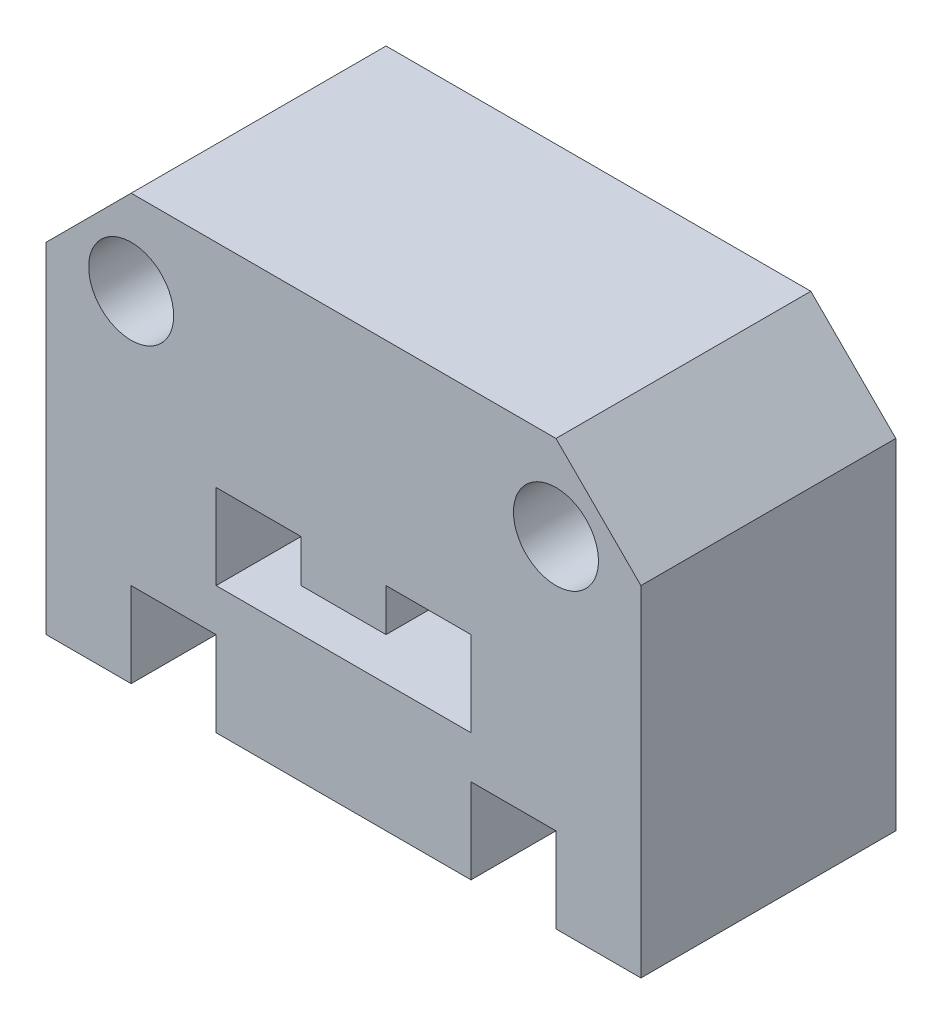
from build123d import *

# Parameters (mm, degrees)
SKETCH2_R           = 5
BOSS_EXTRUDE2_DEPTH = 15


with BuildPart() as part:
    # Sketch2 → Boss-Extrude2 (new, symmetric)
    with BuildSketch(Plane.XY):
        Polygon((10, 10), (10, 50), (20, 60), (70, 60), (80, 50), (80, 10), (70, 10), (70, 20), (60, 20), (60, 10), (30, 10), (30, 20), (20, 20), (20, 10), align=None)
        with Locations((20, 50)):
            Circle(SKETCH2_R, mode=Mode.SUBTRACT)
        with Locations(Location((70, 50, 0), (0, 0, 180))):
            Circle(SKETCH2_R, mode=Mode.SUBTRACT)
        Polygon((50, 30), (40, 30), (40, 35), (30, 35), (30, 25), (60, 25), (60, 35), (50, 35), align=None, mode=Mode.SUBTRACT)
    extrude(amount=BOSS_EXTRUDE2_DEPTH, both=True)


solid = part.part
